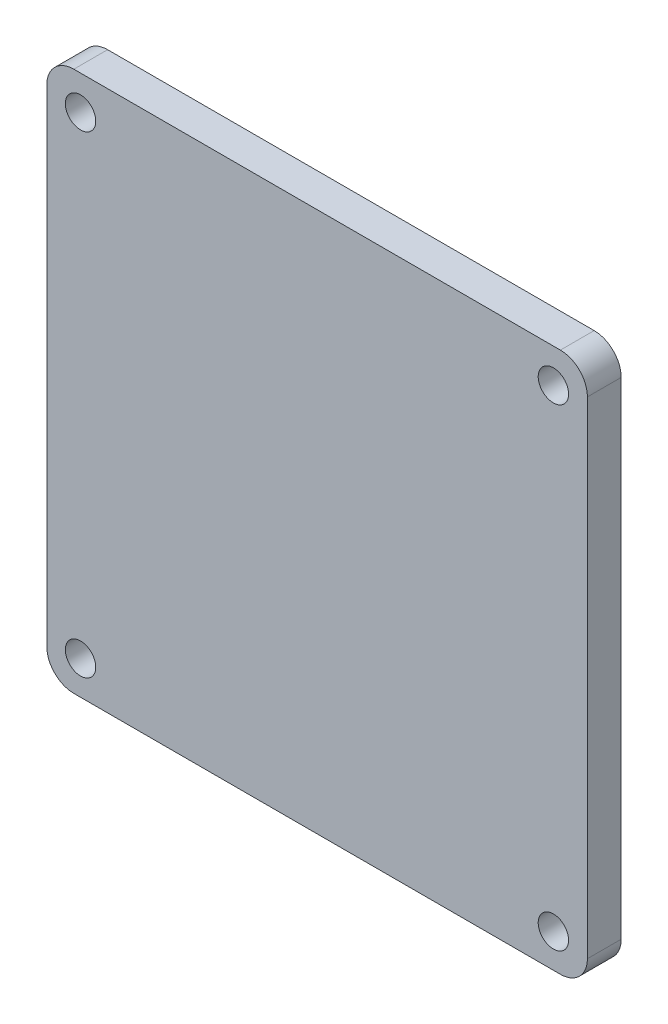
from build123d import *

# Parameters (mm, degrees)
BOSS_EXTRU_1_DEPTH = 5
D_GAGEMENT_M41_D   = 4.5


with BuildPart() as part:
    # Esquisse1 → Boss.-Extru.1 (new body)
    with BuildSketch(Plane.XY):
        with BuildLine():
            Line((-36, -40), (36, -40))
            ThreePointArc((36, -40), (38.828427125, -38.828427125), (40, -36))
            Line((40, -36), (40, 36))
            ThreePointArc((40, 36), (38.828427125, 38.828427125), (36, 40))
            Line((36, 40), (-36, 40))
            ThreePointArc((-36, 40), (-38.828427125, 38.828427125), (-40, 36))
            Line((-40, 36), (-40, -36))
            ThreePointArc((-40, -36), (-38.828427125, -38.828427125), (-36, -40))
        make_face()
    extrude(amount=BOSS_EXTRU_1_DEPTH)

    # Dégagement M41 (through all)
    with Locations(Plane.XY.offset(5)):
        with Locations((-35.007622699, 34.962380164), (34.968353645, 34.962380164), (34.968353645, -35.023881333), (-35.007622699, -35.023881333)):
            Hole(D_GAGEMENT_M41_D / 2)


solid = part.part
